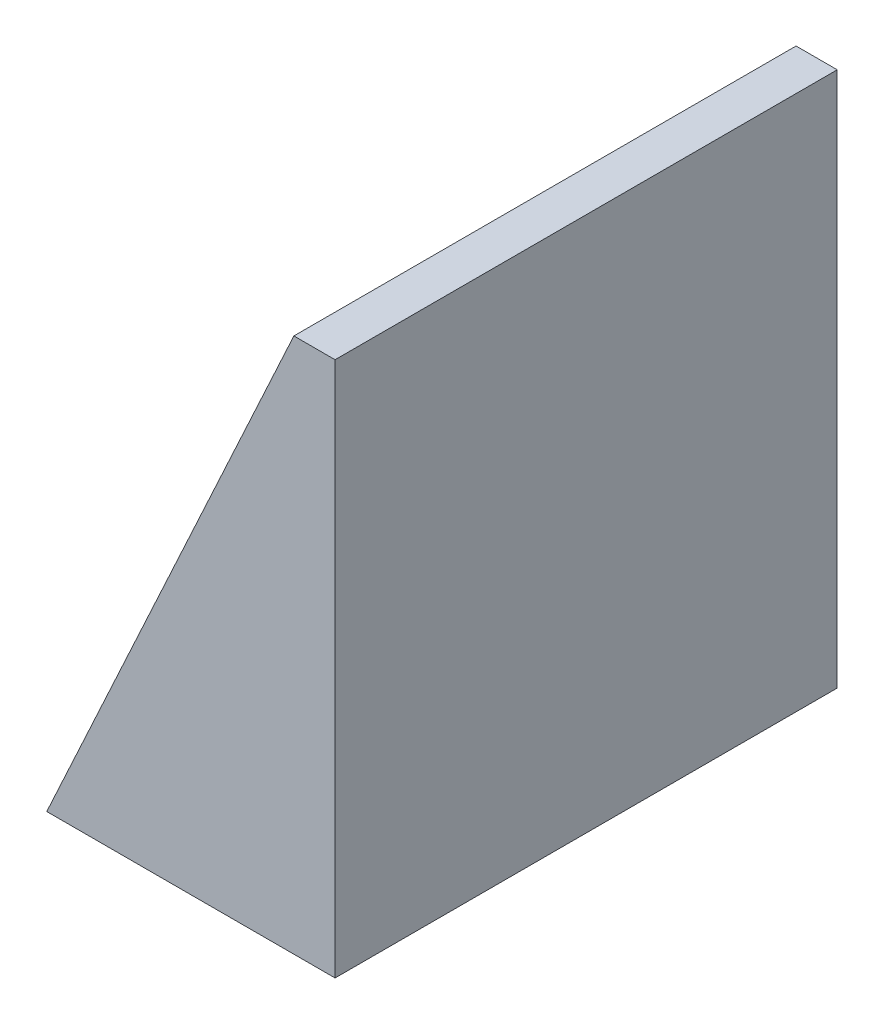
from build123d import *

# Parameters (mm, degrees)
BOSS_EXTRUDE1_DEPTH = 609.6


with BuildPart() as part:
    # Sketch1 → Boss-Extrude1 (new body)
    with BuildSketch(Plane.XY):
        Polygon((0, 0), (50, 0), (50, -650), (-300, -650), align=None)
    extrude(amount=BOSS_EXTRUDE1_DEPTH)


solid = part.part
